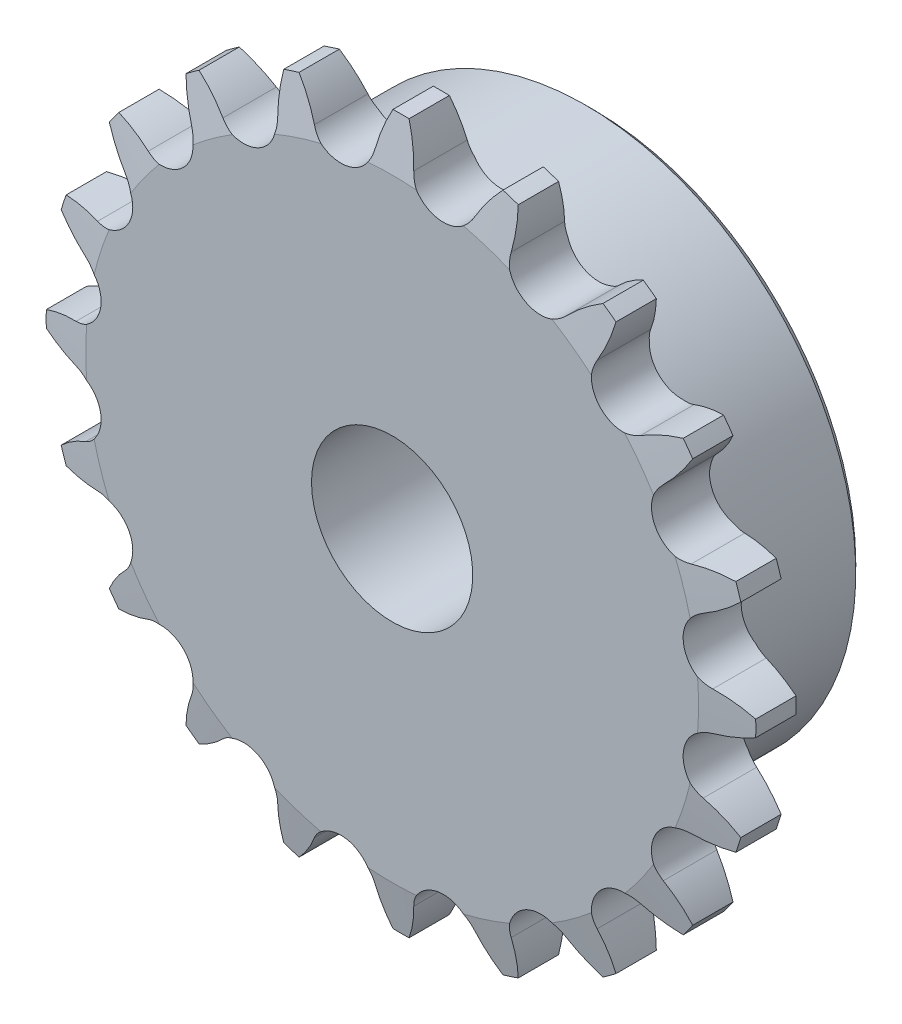
from build123d import *

# Parameters (mm, degrees)
CHAMFER1_SIZE      = 1
CUT_EXTRUDE1_DEPTH = 10
CIRPATTERN1_COUNT  = 20


with BuildPart() as part:
    # Sketch1 → Revolve1 (revolve)
    with BuildSketch(Plane(origin=(0, 0, 0), x_dir=(0, 0, -1), z_dir=(1, 0, 0)), mode=Mode.PRIVATE) as revolve1_sk:
        Polygon((0, 10), (25, 10), (25, 33.5), (7.2, 33.5), (7.2, 38), (6.1, 44), (1.1, 44), (0, 38), align=None)
    revolve(revolve1_sk.sketch.rotate(Axis((0, 0, -27.365268612), (0, 0, 1)), 90), axis=Axis((0, 0, -27.365268612), (0, 0, 1)))

    # Chamfer1
    chamfer1_edges = [part.edges().sort_by_distance(p)[0] for p in [
        (33.5, 0, -25),
    ]]
    chamfer(chamfer1_edges, length=CHAMFER1_SIZE)

    # Sketch2 → Cut-Extrude1 (cut)
    with BuildSketch(Plane.XY):
        with BuildLine():
            ThreePointArc((2.396095129, 39.482645925), (5.723937076, 36.139516382), (9.921986688, 38.290661802))
            ThreePointArc((9.921986688, 38.290661802), (11.139266303, 40.318478916), (12.642179226, 42.144694855))
            ThreePointArc((12.642179226, 42.144694855), (6.883116462, 43.458286986), (1, 43.988634896))
            ThreePointArc((1, 43.988634896), (1.865023368, 41.787374693), (2.396095129, 39.482645925))
        make_face()
    cut_extrude1 = extrude(amount=-CUT_EXTRUDE1_DEPTH, mode=Mode.SUBTRACT)

    # CirPattern1: Cut-Extrude1 ×20 about axis
    cirpattern1_axis = Axis((0, 0, 0), (0, 0, 1))
    for i in range(1, CIRPATTERN1_COUNT):
        add(cut_extrude1.rotate(cirpattern1_axis, i * 360 / CIRPATTERN1_COUNT), mode=Mode.SUBTRACT)


solid = part.part
